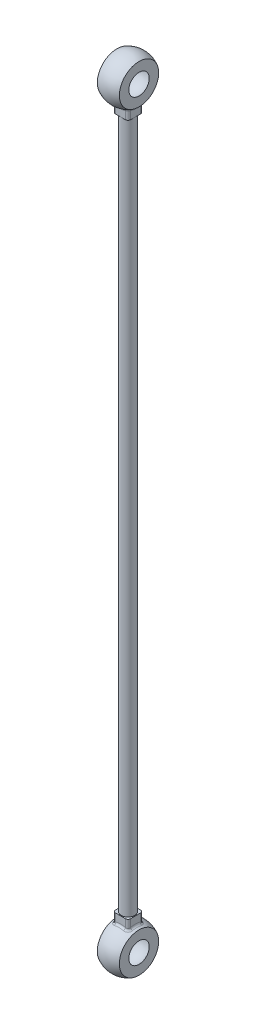
from build123d import *

# Parameters (mm, degrees)
ESQUISSE2_W                = 3.819255876
ESQUISSE2_H                = 8.646526499
ENL_V_MAT_EXTRU_1_DEPTH    = 8.794228634
ESQUISSE3_W                = 3
ESQUISSE3_H                = 2.432871086
BOSS_EXTRU_1_DEPTH         = 1.5
ESQUISSE4_R                = 1.35
BOSS_EXTRU_2_DEPTH         = 69
SYM_TRIE13_COPY_1_SKETCH_W = 3
SYM_TRIE13_COPY_1_SKETCH_H = 2.432871086
SYM_TRIE13_COPY_1_DEPTH    = 1.5
SYM_TRIE13_COPY_2_SKETCH_W = 3
SYM_TRIE13_COPY_2_SKETCH_H = 2.432871086
SYM_TRIE13_COPY_2_DEPTH    = 1.5
CONG_1_R                   = 0.5


with BuildPart() as part:
    # Esquisse1 → Révolution1 (revolve)
    with BuildSketch(Plane.XY):
        with BuildLine():
            Line((0, 4.5), (0, 3))
            ThreePointArc((0, 3), (-3, 0), (0, -3))
            Line((0, -3), (0, -4.5))
            ThreePointArc((0, -4.5), (-4.5, 0), (0, 4.5))
        make_face()
    r_volution1 = revolve(axis=Axis((0, 6.177492986, 0), (0, -1, 0)))

    # Esquisse2 → Enlèv. mat.-Extru.1 (cut, symmetric)
    with BuildSketch(Plane.XY):
        with Locations((4.109627938, -0.050400737)):
            Rectangle(ESQUISSE2_W, ESQUISSE2_H)
        with Locations((-4.109627938, -0.050400737)):
            Rectangle(ESQUISSE2_W, ESQUISSE2_H)
    enl_v_mat_extru_1 = extrude(amount=ENL_V_MAT_EXTRU_1_DEPTH, both=True, mode=Mode.SUBTRACT)

    # Esquisse3 → Boss.-Extru.1 (add, symmetric)
    with BuildSketch(Plane(origin=(0, 0, 0), x_dir=(0, 0, -1), z_dir=(1, 0, 0))):
        with Locations((0, -4.783564457)):
            Rectangle(ESQUISSE3_W, ESQUISSE3_H)
    boss_extru_1 = extrude(amount=BOSS_EXTRU_1_DEPTH, both=True)

    # Esquisse4 → Boss.-Extru.2 (add)
    with BuildSketch(Plane.XZ.offset(6)):
        with Locations(Location((0, 0, 0), (0, 0, 270))):
            Circle(ESQUISSE4_R)
    boss_extru_2 = extrude(amount=BOSS_EXTRU_2_DEPTH)

    # Symétrie11: Boss.-Extru.2 across plane
    add(boss_extru_2.mirror(Plane(origin=(0, -75, 0), x_dir=(0, 0, 1), z_dir=(0, -1, 0))))

    # Symétrie12: Boss.-Extru.1 across plane
    add(boss_extru_1.mirror(Plane(origin=(0, -75, 0), x_dir=(0, 0, 1), z_dir=(0, -1, 0))))

    # Symétrie13: Révolution1 across plane
    add(r_volution1.mirror(Plane(origin=(0, -75, 0), x_dir=(0, 0, 1), z_dir=(0, -1, 0))))

    # Symétrie13 copy 1 sketch → Symétrie13 copy 1 (add, symmetric)
    with BuildSketch(Plane(origin=(0, 0, 0), x_dir=(0, 0, -1), z_dir=(1, 0, 0))):
        with Locations((0, -4.783564457)):
            Rectangle(SYM_TRIE13_COPY_1_SKETCH_W, SYM_TRIE13_COPY_1_SKETCH_H)
    extrude(amount=SYM_TRIE13_COPY_1_DEPTH, both=True)

    # Symétrie13 copy 2 sketch → Symétrie13 copy 2 (add, symmetric)
    with BuildSketch(Plane(origin=(0, -150, 0), x_dir=(0, 0, -1), z_dir=(1, 0, 0))):
        with Locations((0, 4.783564457)):
            Rectangle(SYM_TRIE13_COPY_2_SKETCH_W, SYM_TRIE13_COPY_2_SKETCH_H)
    extrude(amount=SYM_TRIE13_COPY_2_DEPTH, both=True)

    # Symétrie14: Enlèv. mat.-Extru.1 across plane
    add(enl_v_mat_extru_1.mirror(Plane(origin=(0, -75, 0), x_dir=(0, 0, 1), z_dir=(0, -1, 0))), mode=Mode.SUBTRACT)

    # Congé1
    cong_1_edges = [part.edges().sort_by_distance(p)[0] for p in [
        (1.5, -4.242640687, 0),
        (0, -4.242640687, -1.5),
        (0, -4.242640687, 1.5),
        (-1.5, -4.173575101, -0.762411227),
        (-1.5, -4.984313483, 1.5),
        (-1.5, -4.984313483, -1.5),
        (1.5, -4.984313483, -1.5),
        (1.5, -4.984313483, 1.5),
        (1.5, -145.015686517, -1.5),
        (-1.5, -145.015686517, -1.5),
        (1.5, -145.015686517, 1.5),
        (1.5, -145.757359313, 0),
        (-1.5, -145.015686517, 1.5),
        (0, -145.757359313, -1.5),
        (-1.5, -145.826424899, 0.762411227),
        (0, -145.757359313, 1.5),
    ]]
    fillet(cong_1_edges, radius=CONG_1_R)


solid = part.part
